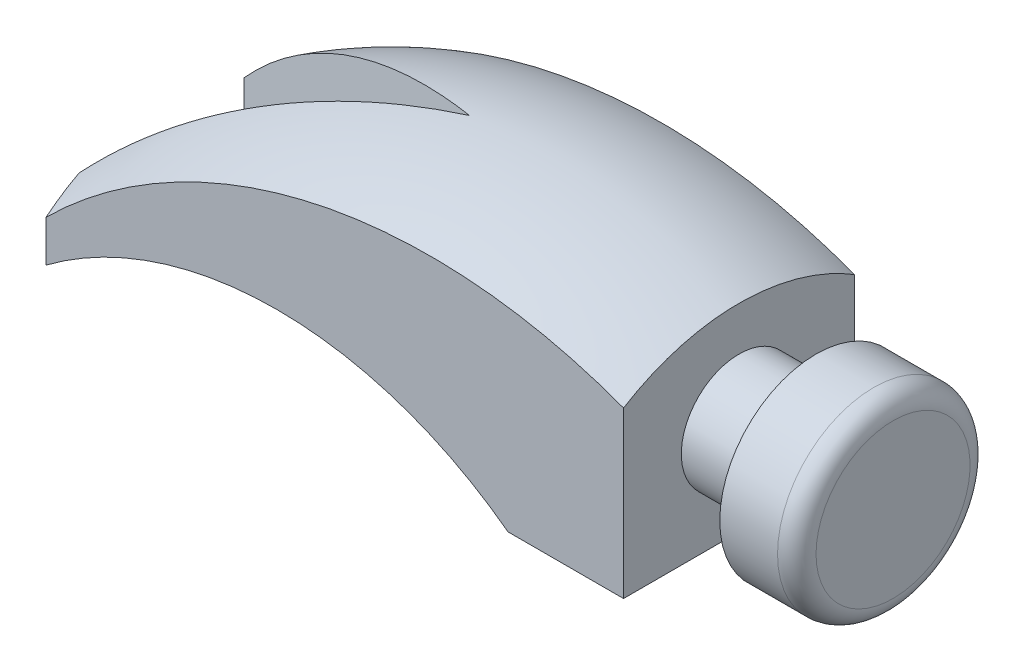
from build123d import *

# Parameters (mm, degrees)
BOSS_EXTRUDE1_DEPTH     = 30
SKETCH3_OUTSIDE_W       = 103.618
SKETCH3_OUTSIDE_H       = 103.618
SKETCH3_OUTSIDE_R       = 25
CUT_EXTRUDE1_DEPTH      = 40
CUT_EXTRUDE2_START      = -20
SKETCH4_OUTSIDE_W       = 103.618
SKETCH4_OUTSIDE_H       = 103.618
SKETCH4_OUTSIDE_R       = 15
CUT_EXTRUDE2_DEPTH      = 20
FILLET1_R               = 5
CUT_EXTRUDE3_REACH      = 148.287
CUT_EXTRUDE3_END_RADIUS = 150


with BuildPart() as part:
    # Sketch2 → Boss-Extrude1 (new, symmetric)
    with BuildSketch(Plane.XY):
        with BuildLine():
            Line((-60, 80), (-60, 101.803398875))
            ThreePointArc((-60, 101.803398875), (10.943058496, 137.158737934), (90, 131.421356237))
            Line((90, 131.421356237), (90, 120))
            Line((90, 120), (110, 120))
            Line((110, 120), (110, 130))
            Line((110, 130), (130, 130))
            Line((130, 130), (130, 80))
            Line((130, 80), (110, 80))
            Line((110, 80), (110, 90))
            Line((110, 90), (90, 90))
            Line((90, 90), (90, 80))
            Line((90, 80), (60, 80))
            ThreePointArc((60, 80), (0, 100), (-60, 80))
        make_face()
    extrude(amount=BOSS_EXTRUDE1_DEPTH, both=True)

    # Sketch3 outside → Cut-Extrude1 (cut)
    with BuildSketch(Plane(origin=(130, 0, 0), x_dir=(0, 0, -1), z_dir=(1, 0, 0))):
        with Locations((0, 110)):
            Rectangle(SKETCH3_OUTSIDE_W, SKETCH3_OUTSIDE_H)
        with Locations((0, 105)):
            Circle(SKETCH3_OUTSIDE_R, mode=Mode.SUBTRACT)
    extrude(amount=-CUT_EXTRUDE1_DEPTH, mode=Mode.SUBTRACT)

    # Sketch4 outside → Cut-Extrude2 (cut)
    with BuildSketch(Plane(origin=(130, 0, 0), x_dir=(0, 0, -1), z_dir=(1, 0, 0)).offset(CUT_EXTRUDE2_START)):
        with Locations((0, 110)):
            Rectangle(SKETCH4_OUTSIDE_W, SKETCH4_OUTSIDE_H)
        with Locations((0, 105)):
            Circle(SKETCH4_OUTSIDE_R, mode=Mode.SUBTRACT)
    extrude(amount=-CUT_EXTRUDE2_DEPTH, mode=Mode.SUBTRACT)

    # Fillet1
    fillet1_edges = [part.edges().sort_by_distance(p)[0] for p in [
        (130, 105, 25),
    ]]
    fillet(fillet1_edges, radius=FILLET1_R)

    # Cut-Extrude3: up to this cylinder (the profile starts inside it)
    cut_extrude3_end = Plane(origin=(40, -10, 0), z_dir=(0, 0, -1)) * Cylinder(CUT_EXTRUDE3_END_RADIUS, 597.574, mode=Mode.PRIVATE)
    # Sketch5 → Cut-Extrude3 (cut, up to the surface)
    with BuildSketch(Plane.XZ.offset(-80), mode=Mode.PRIVATE) as cut_extrude3_sk1:
        Polygon((20, 0), (-60, 21.435935394), (-60, -21.435935394), align=None)
    cut_extrude3_tool1 = extrude(cut_extrude3_sk1.sketch, amount=-CUT_EXTRUDE3_REACH, mode=Mode.PRIVATE) & cut_extrude3_end
    add(cut_extrude3_tool1.solids().sort_by_distance((-33.333333, 80, 0))[0], mode=Mode.SUBTRACT)

    # SurfaceCut4: cut with a surface, the side it looks to stays
    # Surface-Sweep1: a surface, the sketch's curves swept along a path
    with BuildLine(Plane(origin=(40, 0, 0), x_dir=(0, 0, -1), z_dir=(1, 0, 0)), mode=Mode.PRIVATE) as surface_sweep1_1_profile:
        Line((0, 20), (0, 80))
        Line((0, 80), (60, 80))
        ThreePointArc((60, 80), (-42.426406871, 122.426406871), (0, 20))
    with BuildLine(Plane.XY, mode=Mode.PRIVATE) as surface_sweep1_1_along:
        ThreePointArc((104.347571597, 125.49682664), (-0.649478186, 134.387049015), (-85.586612969, 72.024402728))
    surface_sweep1_1 = Shell.sweep(surface_sweep1_1_profile.wire(), surface_sweep1_1_along.wire())
    split(bisect_by=surface_sweep1_1, keep=Keep.TOP)


solid = part.part
